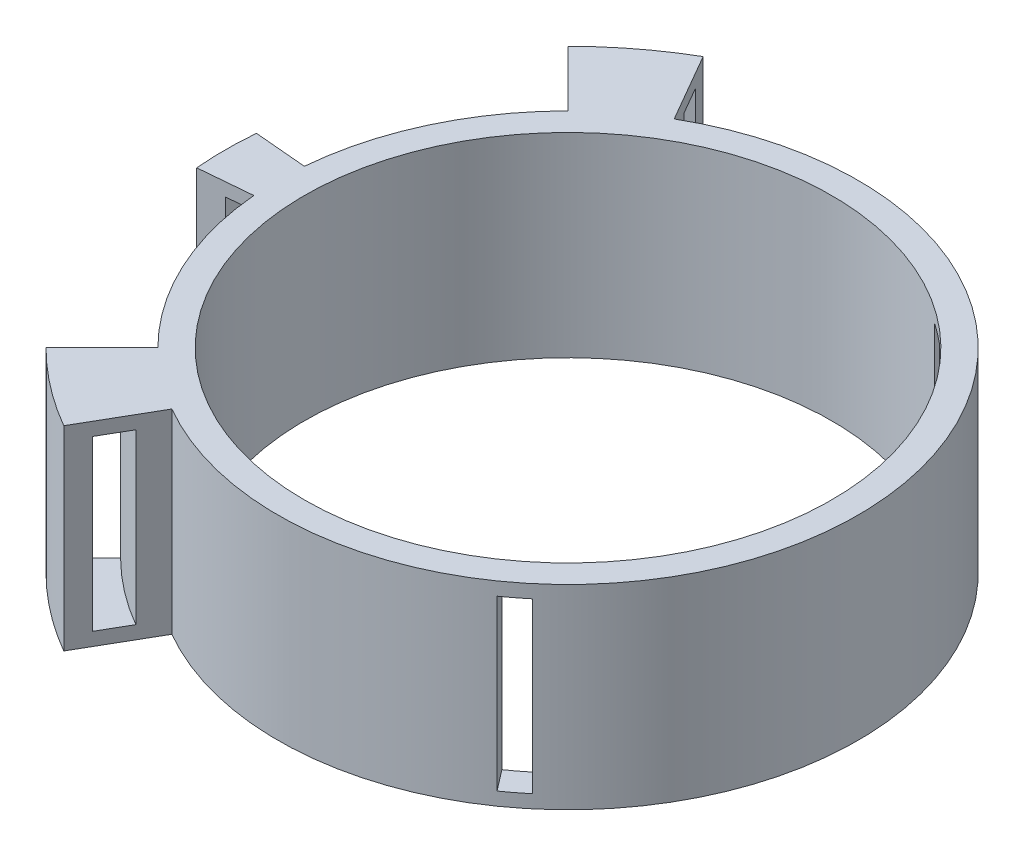
from build123d import *
from build123d.topology import SkipClean

# Parameters (mm, degrees)
EXTRUDE_1_DEPTH = 0.5
EXTRUDE_2_DEPTH = 6.4
EXTRUDE_3_DEPTH = 0.5
EXTRUDE_START   = -7.4
EXTRUDE_6_DEPTH = 7.4
EXTRUDE_7_DEPTH = 6.4
EXTRUDE_8_DEPTH = 0.5


with BuildPart() as part:
    # 草图1 → 凸台-拉伸1 (new body)
    with BuildSketch(Plane(origin=(0, 0, 0), x_dir=(1, 0, 0), z_dir=(0, 1, 0))):
        with BuildLine():
            Line((10.958141679, 0.95871317), (9.961946981, 0.871557427))
            ThreePointArc((9.961946981, 0.871557427), (-10, 0), (9.961946981, -0.871557427))
            Line((9.961946981, -0.871557427), (10.958141679, -0.95871317))
            ThreePointArc((10.958141679, -0.95871317), (5.079234746, -9.757119165), (-5.5, -9.526279442))
            Line((-5.5, -9.526279442), (-7, -12.124355653))
            ThreePointArc((-7, -12.124355653), (-8.522660006, -11.106946764), (-9.899494937, -9.899494937))
            Line((-9.899494937, -9.899494937), (-7.778174593, -7.778174593))
            ThreePointArc((-7.778174593, -7.778174593), (-9.969385657, -4.648800879), (-10.958141679, -0.95871317))
            Line((-10.958141679, -0.95871317), (-12.950531075, -1.133024656))
            ThreePointArc((-12.950531075, -1.133024656), (-13, 0), (-12.950531075, 1.133024656))
            Line((-12.950531075, 1.133024656), (-10.958141679, 0.95871317))
            ThreePointArc((-10.958141679, 0.95871317), (-9.969385657, 4.648800879), (-7.778174593, 7.778174593))
            Line((-7.778174593, 7.778174593), (-9.899494937, 9.899494937))
            ThreePointArc((-9.899494937, 9.899494937), (-8.522660006, 11.106946764), (-7, 12.124355653))
            Line((-7, 12.124355653), (-5.5, 9.526279442))
            ThreePointArc((-5.5, 9.526279442), (5.079234746, 9.757119165), (10.958141679, 0.95871317))
        make_face()
    extrude(amount=EXTRUDE_1_DEPTH)

    # 草图10 → 凸台-拉伸2 (add)
    with BuildSketch(Plane(origin=(0, 0.5, 0), x_dir=(1, 0, 0), z_dir=(0, 1, 0))):
        with BuildLine():
            Line((9.961946981, -0.871557427), (10.958141679, -0.95871317))
            ThreePointArc((10.958141679, -0.95871317), (9.757119165, -5.079234746), (7.070663707, -8.426488874))
            Line((7.070663707, -8.426488874), (6.427876097, -7.660444431))
            ThreePointArc((6.427876097, -7.660444431), (8.870108332, -4.617486132), (9.961946981, -0.871557427))
        make_face()
        with BuildLine():
            Line((9.961946981, 0.871557427), (10.958141679, 0.95871317))
            ThreePointArc((10.958141679, 0.95871317), (9.744466641, 5.103466458), (7.028695203, 8.46152727))
            Line((7.028695203, 8.46152727), (6.389722912, 7.692297518))
            ThreePointArc((6.389722912, 7.692297518), (8.858606037, 4.639514962), (9.961946981, 0.871557427))
        make_face()
        with BuildLine():
            Line((6.314487726, -9.007066379), (5.704869745, -8.213066491))
            ThreePointArc((5.704869745, -8.213066491), (-9.999967824, -0.025367673), (5.663127179, 8.241904547))
            Line((5.663127179, 8.241904547), (6.268753512, 9.038956212))
            ThreePointArc((6.268753512, 9.038956212), (-10.999964675, -0.027877319), (6.314487726, -9.007066379))
        make_face()
    extrude(amount=EXTRUDE_2_DEPTH)

    # 草图11 → 凸台-拉伸3 (add)
    with SkipClean():  # the faces are left unmerged after this step: merging them gives an invalid solid
        with BuildSketch(Plane(origin=(0, 6.9, 0), x_dir=(1, 0, 0), z_dir=(0, 1, 0))):
            with BuildLine():
                Line((9.961946981, 0.871557427), (10.958141679, 0.95871317))
                ThreePointArc((10.958141679, 0.95871317), (-11, 0), (10.958141679, -0.95871317))
                Line((10.958141679, -0.95871317), (9.961946981, -0.871557427))
                ThreePointArc((9.961946981, -0.871557427), (-10, 0), (9.961946981, 0.871557427))
            make_face()
        extrude(amount=EXTRUDE_3_DEPTH)

    # 草图14 → 凸台-拉伸6 (add)
    with SkipClean():  # the faces are left unmerged after this step: merging them gives an invalid solid
        with BuildSketch(Plane(origin=(0, 7.4, 0), x_dir=(1, 0, 0), z_dir=(0, 1, 0)).offset(EXTRUDE_START)):
            with BuildLine():
                Line((9.961946981, 0.871557427), (10.958141679, 0.95871317))
                ThreePointArc((10.958141679, 0.95871317), (11, 0), (10.958141679, -0.95871317))
                Line((10.958141679, -0.95871317), (9.961946981, -0.871557427))
                ThreePointArc((9.961946981, -0.871557427), (10, 0), (9.961946981, 0.871557427))
            make_face()
        extrude(amount=EXTRUDE_6_DEPTH)

    # 草图12 → 凸台-拉伸7 (add)
    with SkipClean():  # the faces are left unmerged after this step: merging them gives an invalid solid
        with BuildSketch(Plane(origin=(0, 0.5, 0), x_dir=(1, 0, 0), z_dir=(0, 1, 0))):
            with BuildLine():
                Line((-7.778174593, -7.778174593), (-8.485281374, -8.485281374))
                ThreePointArc((-8.485281374, -8.485281374), (-7.305137148, -9.520240083), (-6, -10.392304845))
                Line((-6, -10.392304845), (-5.5, -9.526279442))
                ThreePointArc((-5.5, -9.526279442), (-6.696375719, -8.726886743), (-7.778174593, -7.778174593))
            make_face()
            with BuildLine():
                Line((-9.899494937, -9.899494937), (-9.333809512, -9.333809512))
                ThreePointArc((-9.333809512, -9.333809512), (-8.035650863, -10.472264092), (-6.6, -11.43153533))
                Line((-6.6, -11.43153533), (-7, -12.124355653))
                ThreePointArc((-7, -12.124355653), (-8.522660006, -11.106946764), (-9.899494937, -9.899494937))
            make_face()
            with BuildLine():
                Line((-9.899494937, 9.899494937), (-9.333809512, 9.333809512))
                ThreePointArc((-9.333809512, 9.333809512), (-8.035650863, 10.472264092), (-6.6, 11.43153533))
                Line((-6.6, 11.43153533), (-7, 12.124355653))
                ThreePointArc((-7, 12.124355653), (-8.522660006, 11.106946764), (-9.899494937, 9.899494937))
            make_face()
            with BuildLine():
                Line((-5.5, 9.526279442), (-6, 10.392304845))
                ThreePointArc((-6, 10.392304845), (-7.305137148, 9.520240083), (-8.485281374, 8.485281374))
                Line((-8.485281374, 8.485281374), (-7.778174593, 7.778174593))
                ThreePointArc((-7.778174593, 7.778174593), (-6.696375719, 8.726886743), (-5.5, 9.526279442))
            make_face()
            with BuildLine():
                Line((-12.950531075, 1.133024656), (-11.954336377, 1.045868913))
                ThreePointArc((-11.954336377, 1.045868913), (-12, 0), (-11.954336377, -1.045868913))
                Line((-11.954336377, -1.045868913), (-12.950531075, -1.133024656))
                ThreePointArc((-12.950531075, -1.133024656), (-13, 0), (-12.950531075, 1.133024656))
            make_face()
        extrude(amount=EXTRUDE_7_DEPTH)

    # 草图15 → 凸台-拉伸8 (add)
    with SkipClean():  # the faces are left unmerged after this step: merging them gives an invalid solid
        with BuildSketch(Plane(origin=(0, 6.9, 0), x_dir=(1, 0, 0), z_dir=(0, 1, 0))):
            with BuildLine():
                Line((-12.950531075, 1.133024656), (-10.958141679, 0.95871317))
                ThreePointArc((-10.958141679, 0.95871317), (-11, 0), (-10.958141679, -0.95871317))
                Line((-10.958141679, -0.95871317), (-12.950531075, -1.133024656))
                ThreePointArc((-12.950531075, -1.133024656), (-13, 0), (-12.950531075, 1.133024656))
            make_face()
            with BuildLine():
                Line((-9.899494937, -9.899494937), (-7.778174593, -7.778174593))
                ThreePointArc((-7.778174593, -7.778174593), (-6.696375719, -8.726886743), (-5.5, -9.526279442))
                Line((-5.5, -9.526279442), (-7, -12.124355653))
                ThreePointArc((-7, -12.124355653), (-8.522660006, -11.106946764), (-9.899494937, -9.899494937))
            make_face()
            with BuildLine():
                Line((-9.899494937, 9.899494937), (-7.778174593, 7.778174593))
                ThreePointArc((-7.778174593, 7.778174593), (-6.696375719, 8.726886743), (-5.5, 9.526279442))
                Line((-5.5, 9.526279442), (-7, 12.124355653))
                ThreePointArc((-7, 12.124355653), (-8.522660006, 11.106946764), (-9.899494937, 9.899494937))
            make_face()
        extrude(amount=EXTRUDE_8_DEPTH)


solid = part.part
